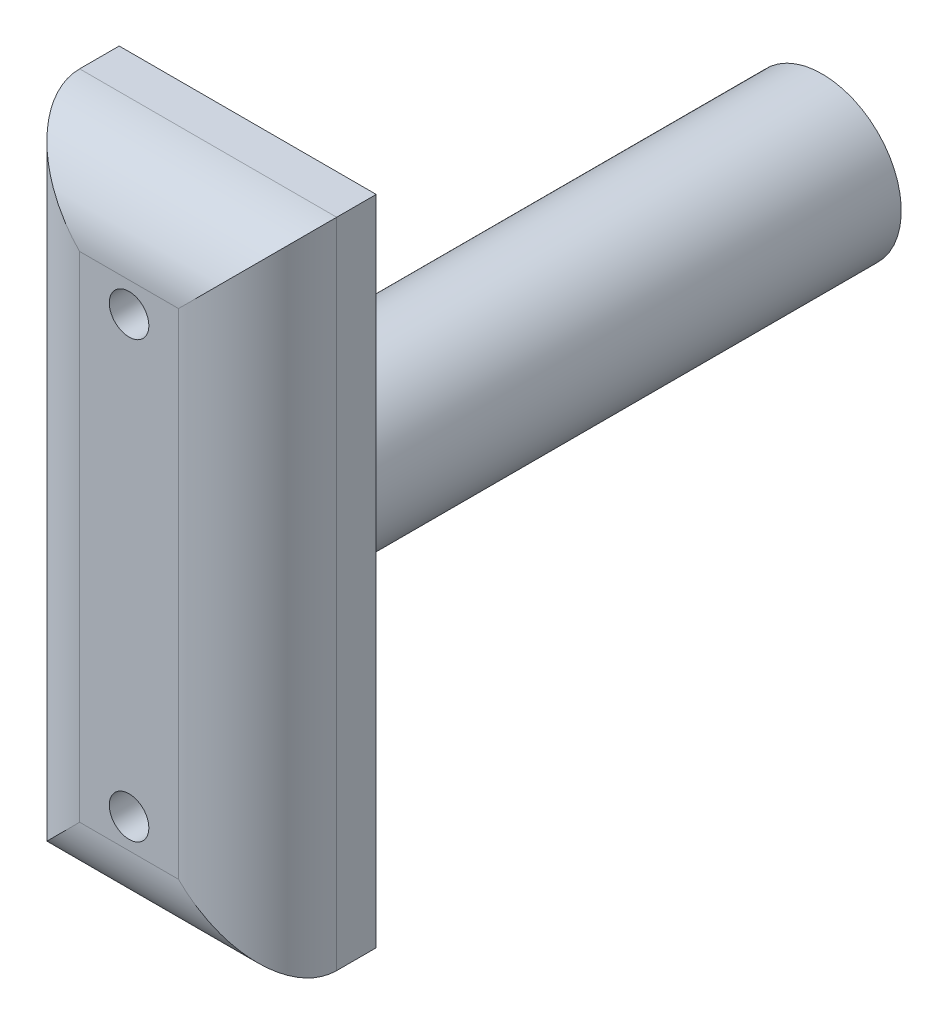
from build123d import *

# Parameters (mm, degrees)
SKETCH1_W           = 13
SKETCH1_H           = 33
BOSS_EXTRUDE1_DEPTH = 6
SKETCH2_R           = 4
BOSS_EXTRUDE2_DEPTH = 29.05598176
CUT_EXTRUDE1_REACH  = 41.286
SKETCH3_R           = 1
FILLET1_R           = 4


with BuildPart() as part:
    # Sketch1 → Boss-Extrude1 (new body)
    with BuildSketch(Plane.XY):
        Rectangle(SKETCH1_W, SKETCH1_H)
    extrude(amount=BOSS_EXTRUDE1_DEPTH)

    # Sketch2 → Boss-Extrude2 (add)
    with BuildSketch(Plane(origin=(0, 0, 0), x_dir=(-1, 0, 0), z_dir=(0, 0, -1))):
        Circle(SKETCH2_R)
    extrude(amount=BOSS_EXTRUDE2_DEPTH)

    # Sketch3 → Cut-Extrude1 (cut, up to next)
    with BuildSketch(Plane.XY.offset(6), mode=Mode.PRIVATE) as cut_extrude1_sk1:
        with Locations((0, 11)):
            Circle(SKETCH3_R)
    cut_extrude1_tool1 = extrude(cut_extrude1_sk1.sketch, amount=-CUT_EXTRUDE1_REACH, mode=Mode.PRIVATE) & part.part
    # Sketch3 → Cut-Extrude1 (cut, up to next)
    with BuildSketch(Plane.XY.offset(6), mode=Mode.PRIVATE) as cut_extrude1_sk2:
        with Locations((0, -11)):
            Circle(SKETCH3_R)
    cut_extrude1_tool2 = extrude(cut_extrude1_sk2.sketch, amount=-CUT_EXTRUDE1_REACH, mode=Mode.PRIVATE) & part.part
    add(cut_extrude1_tool1.solids().sort_by_distance((0, 11, 6))[0], mode=Mode.SUBTRACT)
    add(cut_extrude1_tool2.solids().sort_by_distance((0, -11, 6))[0], mode=Mode.SUBTRACT)

    # Fillet1
    fillet1_edges = [part.edges().sort_by_distance(p)[0] for p in [
        (6.5, 0, 6),
        (0, 16.5, 6),
        (-6.5, 0, 6),
        (0, -16.5, 6),
    ]]
    fillet(fillet1_edges, radius=FILLET1_R)


solid = part.part
